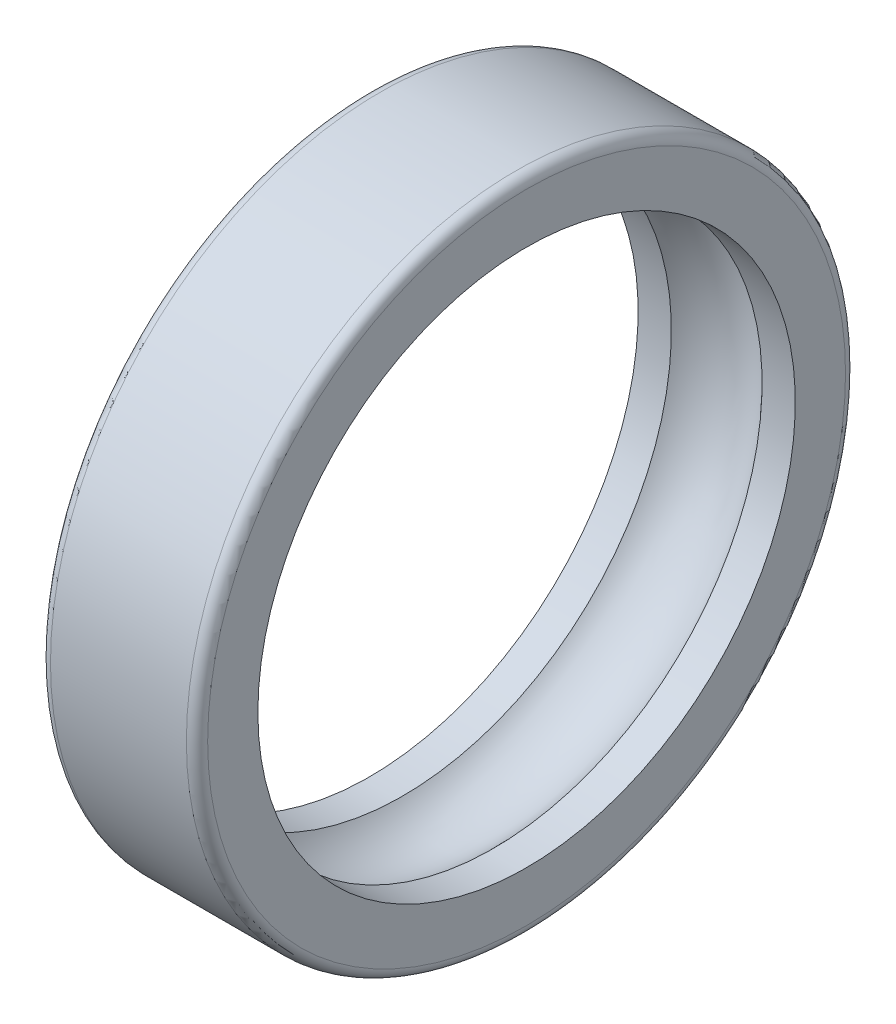
from build123d import *

# Parameters (mm, degrees)
FILLET1_R = 2.1


with BuildPart() as part:
    # Sketch1 → Revolve2 (revolve)
    with BuildSketch(Plane.XY, mode=Mode.PRIVATE) as revolve2_sk:
        with BuildLine():
            Line((-15.5, 65), (15.5, 65))
            Line((15.5, 65), (15.5, 53))
            Line((15.5, 53), (8.94427191, 53))
            ThreePointArc((8.94427191, 53), (0, 57), (-8.94427191, 53))
            Line((-8.94427191, 53), (-15.5, 53))
            Line((-15.5, 53), (-15.5, 65))
        make_face()
    revolve(revolve2_sk.sketch.rotate(Axis((-3.343259563, 0, 0), (1, 0, 0)), 90), axis=Axis((-3.343259563, 0, 0), (1, 0, 0)))

    # Fillet1
    fillet1_edges = [part.edges().sort_by_distance(p)[0] for p in [
        (15.5, 0, -65),
        (-15.5, 0, -65),
    ]]
    fillet(fillet1_edges, radius=FILLET1_R)


solid = part.part
